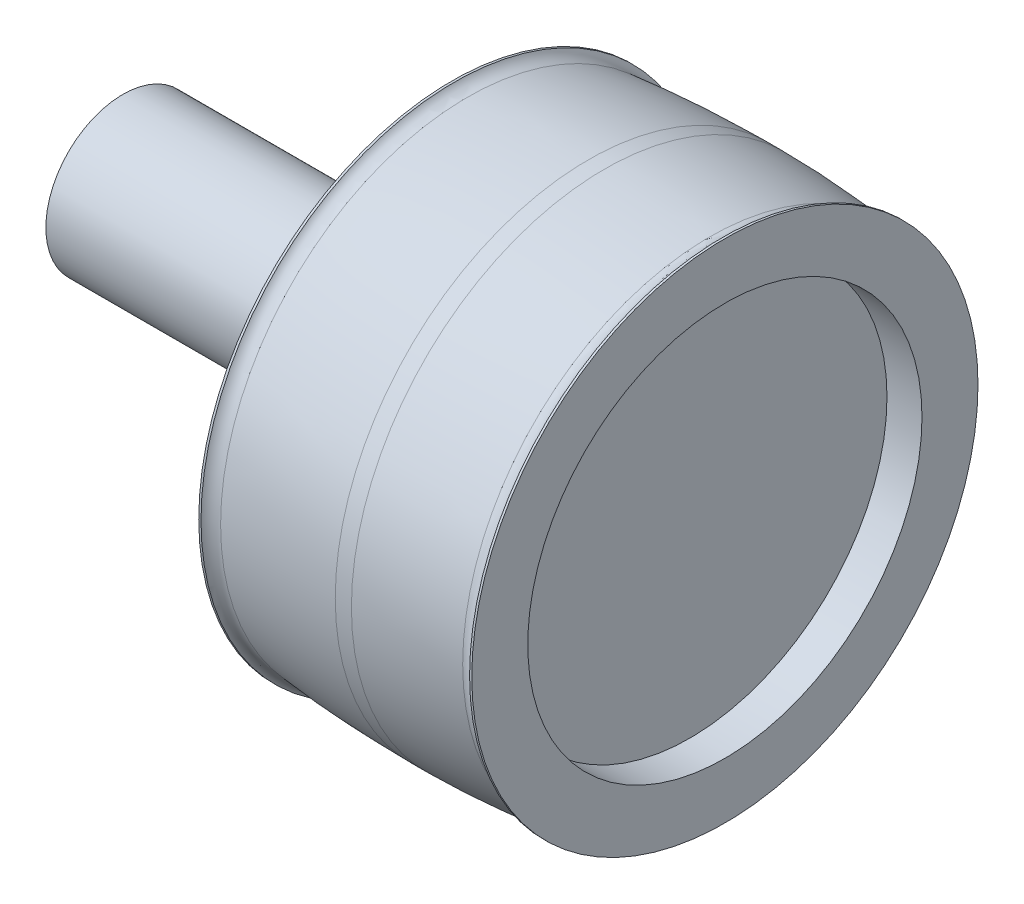
from build123d import *

# Parameters (mm, degrees)
BOSS_EXTRU_1_DEPTH      = 9.75
BOSS_EXTRU_1_DEPTH_BACK = 9.75
ESQUISSE2_R             = 18.08
ESQUISSE4_R             = 14.08
ENL_V_MAT_EXTRU_1_DEPTH = 2.5
ENL_V_START             = -2.5
ESQUISSE5_R             = 14.08
ENL_V_MAT_EXTRU_2_DEPTH = 2.5
ESQUISSE6_R             = 5.5
BOSS_EXTRU_2_DEPTH      = 26


with BuildPart() as part:
    # Esquisse2 → Boss.-Extru.1 (new, two sides: drawn at the far end of the back side and taken through both)
    with BuildSketch(Plane(origin=(0, 0, 0), x_dir=(0, 0, -1), z_dir=(1, 0, 0)).offset(-BOSS_EXTRU_1_DEPTH_BACK)):
        with Locations((0, -30.697276077)):
            Circle(ESQUISSE2_R)
    extrude(amount=BOSS_EXTRU_1_DEPTH + BOSS_EXTRU_1_DEPTH_BACK)

    # Enlèvement de matière-Balayage1: sweep along a curve in space
    with BuildLine() as enl_vement_de_mati_re_balayage1_path:
        ThreePointArc((9.75, -30.697276077, -18.08), (9.75, -17.912785473, -12.784490604), (9.75, -12.617276077, 0))
        ThreePointArc((9.75, -12.617276077, 0), (9.75, -17.912785473, 12.784490604), (9.75, -30.697276077, 18.08))
        ThreePointArc((9.75, -30.697276077, 18.08), (9.75, -43.481766681, 12.784490604), (9.75, -48.777276077, 0))
        ThreePointArc((9.75, -48.777276077, 0), (9.75, -43.481766681, -12.784490604), (9.75, -30.697276077, -18.08))
    # Esquisse1 → Enlèvement de matière-Balayage1 (sweep, cut)
    with BuildSketch(Plane.XY):
        with BuildLine():
            Line((9.75, -1.705844805), (9.75, -12.080482835))
            ThreePointArc((9.75, -12.080482835), (9.418659658, -12.824051434), (8.644211477, -13.074871486))
            add(Edge.make_bspline(
                [(-8.639497918, -13.06789707), (-5.962658662, -12.770278108), (1.018950966, -12.480757929), (5.401157061, -12.729857554), (8.644211477, -13.074871486)],
                knots=[0.057340546, 0.057340546, 0.057340546, 0.057340546, 0.473274059, 0.946548119, 0.946548119, 0.946548119, 0.946548119], degree=3))
            ThreePointArc((-8.639497918, -13.06789707), (-9.416895013, -12.819172867), (-9.75, -12.074021177))
            Line((-9.75, -12.074021177), (-9.75, -1.69364433))
            ThreePointArc((-9.75, -1.69364433), (-9.265544866, -0.388606491), (-8.04687624, 0.284199066))
            add(Edge.make_bspline(
                [(-8.04687624, 0.284199066), (-5.709420251, 0.63505351), (1.539056453, 0.939568483), (5.000411491, 0.71370426), (8.036962294, 0.273461297)],
                knots=[0.08950135, 0.08950135, 0.08950135, 0.08950135, 0.457115955, 0.91423191, 0.91423191, 0.91423191, 0.91423191], degree=3))
            ThreePointArc((8.036962294, 0.273461297), (9.262270576, -0.397014141), (9.75, -1.705844805))
        make_face()
    sweep(path=enl_vement_de_mati_re_balayage1_path.line, mode=Mode.SUBTRACT)

    # Esquisse4 → Enlèv. mat.-Extru.1 (cut)
    with BuildSketch(Plane(origin=(9.75, 0, 0), x_dir=(0, 0, -1), z_dir=(1, 0, 0))):
        with Locations((0, -30.697276077)):
            Circle(ESQUISSE4_R)
    extrude(amount=-ENL_V_MAT_EXTRU_1_DEPTH, mode=Mode.SUBTRACT)

    # Esquisse5 → Enlèv. mat.-Extru.2 (cut)
    with BuildSketch(Plane.ZY.offset(9.75).offset(ENL_V_START)):
        with Locations((0, -30.697276077)):
            Circle(ESQUISSE5_R)
    extrude(amount=ENL_V_MAT_EXTRU_2_DEPTH, mode=Mode.SUBTRACT)

    # Esquisse6 → Boss.-Extru.2 (add)
    with BuildSketch(Plane.ZY.offset(7.25)):
        with Locations((0, -30.697276077)):
            Circle(ESQUISSE6_R)
    extrude(amount=BOSS_EXTRU_2_DEPTH)


solid = part.part
